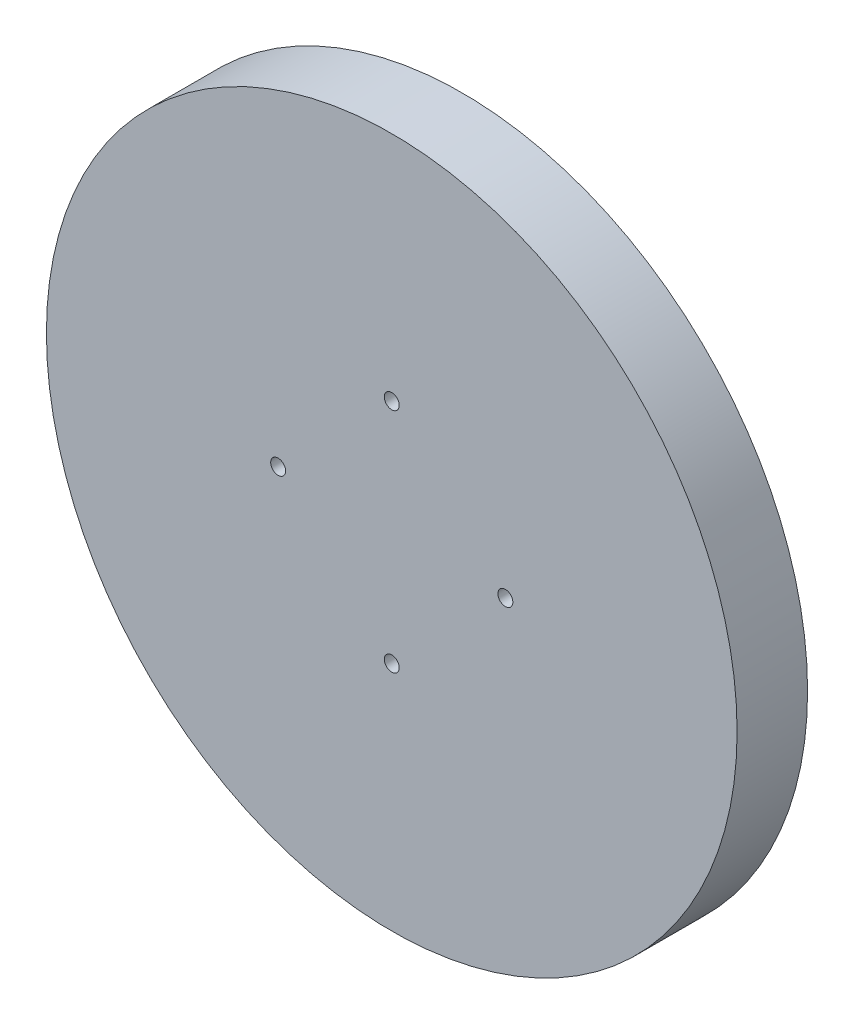
from build123d import *

# Parameters (mm, degrees)
ESQUISSE1_R                  = 24.5
BOSS_EXTRU_1_DEPTH           = 5
ESQUISSE2_R                  = 0.53
ENL_V_MAT_EXTRU_1_DEPTH      = 5
R_P_TITION_CIRCULAIRE1_COUNT = 4


with BuildPart() as part:
    # Esquisse1 → Boss.-Extru.1 (new body)
    with BuildSketch(Plane.XY):
        Circle(ESQUISSE1_R)
    extrude(amount=BOSS_EXTRU_1_DEPTH)

    # Esquisse2 → Enlèv. mat.-Extru.1 (cut)
    with BuildSketch(Plane.XY.offset(5)):
        with Locations((0, 8.06)):
            Circle(ESQUISSE2_R)
    enl_v_mat_extru_1 = extrude(amount=-ENL_V_MAT_EXTRU_1_DEPTH, mode=Mode.SUBTRACT)

    # Répétition circulaire1: Enlèv. mat.-Extru.1 ×4 about axis
    r_p_tition_circulaire1_axis = Axis((0, 0, 0), (0, 0, 1))
    for i in range(1, R_P_TITION_CIRCULAIRE1_COUNT):
        add(enl_v_mat_extru_1.rotate(r_p_tition_circulaire1_axis, i * 360 / R_P_TITION_CIRCULAIRE1_COUNT), mode=Mode.SUBTRACT)


solid = part.part
